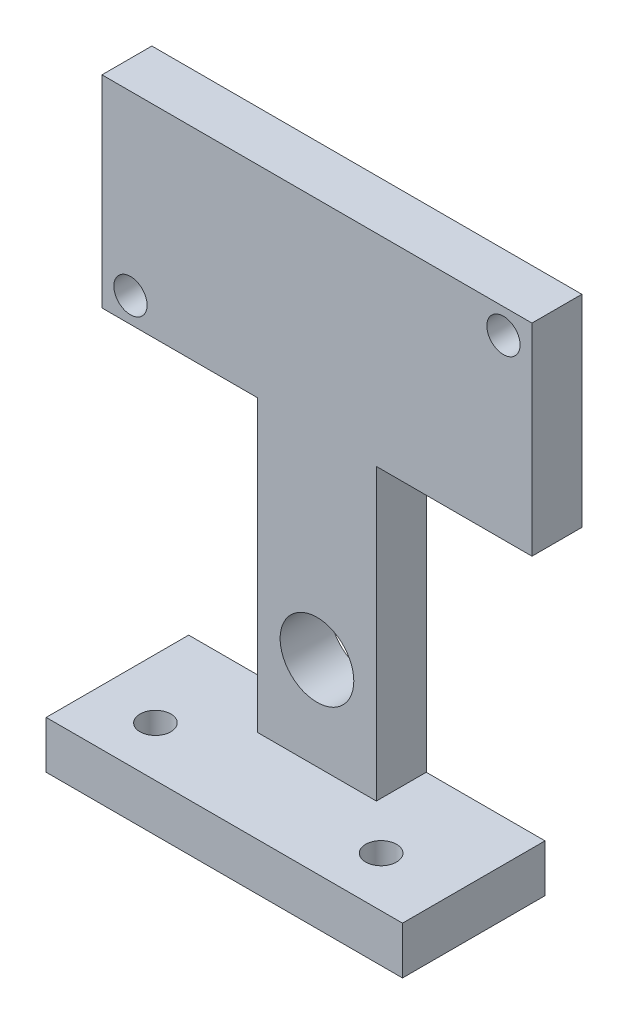
from build123d import *

# Parameters (mm, degrees)
SKETCH1_W           = 38.1
SKETCH1_H           = 15.24
BOSS_EXTRUDE1_DEPTH = 5.08
SKETCH2_R           = 1.651
CUT_EXTRUDE1_DEPTH  = 119.490202326
SKETCH3_W           = 12.7
SKETCH3_H           = 5.334
BOSS_EXTRUDE2_DEPTH = 30.988
SKETCH6_W           = 45.974
SKETCH6_H           = 5.334
BOSS_EXTRUDE3_DEPTH = 21.59
SKETCH7_R           = 1.778
CUT_EXTRUDE4_DEPTH  = 118.755224526
SKETCH8_R           = 3.937
CUT_EXTRUDE5_DEPTH  = 118.755224526


with BuildPart() as part:
    # Sketch1 → Boss-Extrude1 (new body)
    with BuildSketch(Plane(origin=(0, 0, 0), x_dir=(1, 0, 0), z_dir=(0, 1, 0))):
        with Locations((-81.911608108, 54.193229454)):
            Rectangle(SKETCH1_W, SKETCH1_H)
    extrude(amount=-BOSS_EXTRUDE1_DEPTH)

    # Sketch2 → Cut-Extrude1 (cut, through all)
    with BuildSketch(Plane(origin=(0, 0, 0), x_dir=(1, 0, 0), z_dir=(0, 1, 0))):
        with Locations(Location((-94.611608108, 51.907229454, 0), (0, 0, 270))):
            Circle(SKETCH2_R)
        with Locations(Location((-70.481608108, 51.907229454, 0), (0, 0, 270))):
            Circle(SKETCH2_R)
    extrude(amount=-CUT_EXTRUDE1_DEPTH, mode=Mode.SUBTRACT)

    # Sketch3 → Boss-Extrude2 (add)
    with BuildSketch(Plane(origin=(0, 0, 0), x_dir=(1, 0, 0), z_dir=(0, 1, 0))):
        with Locations((-81.911608108, 59.146229454)):
            Rectangle(SKETCH3_W, SKETCH3_H)
    extrude(amount=BOSS_EXTRUDE2_DEPTH)

    # Sketch6 → Boss-Extrude3 (add)
    with BuildSketch(Plane(origin=(0, 30.988, 0), x_dir=(1, 0, 0), z_dir=(0, 1, 0))):
        with Locations((-81.911608108, 59.146229454)):
            Rectangle(SKETCH6_W, SKETCH6_H)
    extrude(amount=BOSS_EXTRUDE3_DEPTH)

    # Sketch7 → Cut-Extrude4 (cut, through all)
    with BuildSketch(Plane.XY.offset(-56.479229454)):
        with Locations((-101.850608108, 33.655)):
            Circle(SKETCH7_R)
        with Locations((-61.972608108, 49.911)):
            Circle(SKETCH7_R)
    extrude(amount=-CUT_EXTRUDE4_DEPTH, mode=Mode.SUBTRACT)

    # Sketch8 → Cut-Extrude5 (cut, through all)
    with BuildSketch(Plane.XY.offset(-56.479229454)):
        with Locations((-81.911608108, 9.906)):
            Circle(SKETCH8_R)
    extrude(amount=-CUT_EXTRUDE5_DEPTH, mode=Mode.SUBTRACT)


solid = part.part
